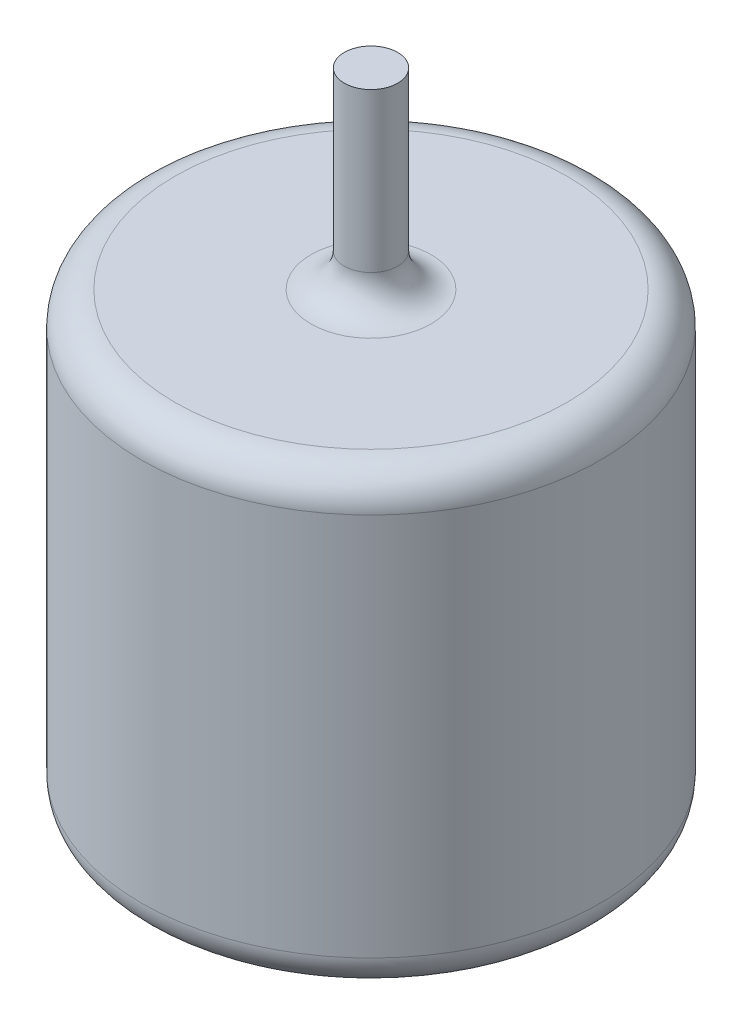
from build123d import *

# Parameters (mm, degrees)
CROQUIS1_R              = 13.75
SALIENTE_EXTRUIR1_DEPTH = 27
CROQUIS3_R              = 1.6
SALIENTE_EXTRUIR2_DEPTH = 11.5
REDONDEO1_R             = 2


with BuildPart() as part:
    # Croquis1 → Saliente-Extruir1 (new body)
    with BuildSketch(Plane(origin=(0, 0, 0), x_dir=(1, 0, 0), z_dir=(0, 1, 0))):
        with Locations(Location((0, 0, 0), (0, 0, 270))):
            Circle(CROQUIS1_R)
    extrude(amount=SALIENTE_EXTRUIR1_DEPTH)

    # Croquis3 → Saliente-Extruir2 (add)
    with BuildSketch(Plane(origin=(0, 27, 0), x_dir=(1, 0, 0), z_dir=(0, 1, 0))):
        with Locations(Location((0, 0, 0), (0, 0, 270))):
            Circle(CROQUIS3_R)
    extrude(amount=SALIENTE_EXTRUIR2_DEPTH)

    # Redondeo1
    redondeo1_edges = [part.edges().sort_by_distance(p)[0] for p in [
        (0, 0, -13.75),
        (0, 27, -13.75),
        (0, 27, -1.6),
    ]]
    fillet(redondeo1_edges, radius=REDONDEO1_R)


solid = part.part
